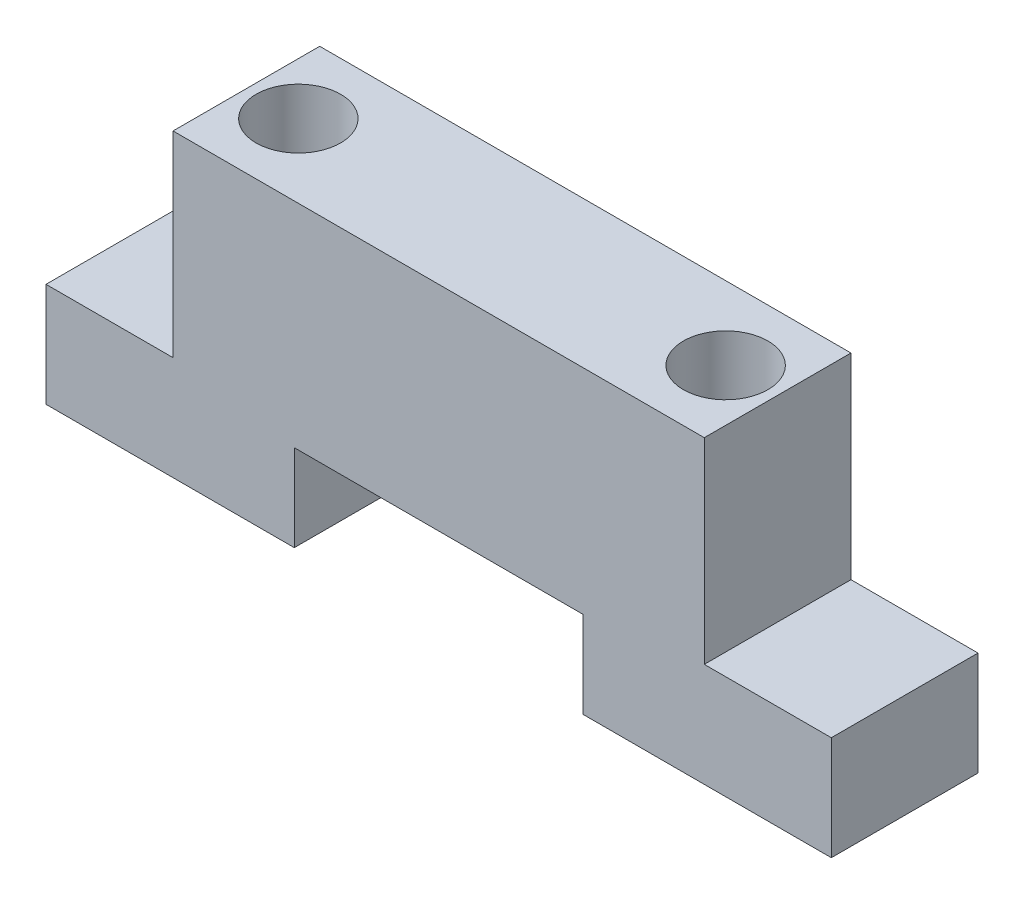
from build123d import *

# Parameters (mm, degrees)
BOSS_EXTRUDE1_DEPTH   = 6.35
F_6_CLEARANCE_HOLE1_D = 3.6576


with BuildPart() as part:
    # Sketch1 → Boss-Extrude1 (new body)
    with BuildSketch(Plane.XY):
        Polygon((0, 0), (0, 4.5), (5.5, 4.5), (5.5, 13), (28.5, 13), (28.5, 4.5), (34, 4.5), (34, 0), (23.25, 0), (23.25, 3.75), (10.75, 3.75), (10.75, 0), align=None)
    extrude(amount=BOSS_EXTRUDE1_DEPTH)

    # #6 Clearance Hole1 (through all)
    with Locations(Plane(origin=(26.25, 13, 3.175), x_dir=(0, 0, 1), z_dir=(0, 1, 0))):
        with Locations((0, 0), (0, -18.5)):
            Hole(F_6_CLEARANCE_HOLE1_D / 2)


solid = part.part
